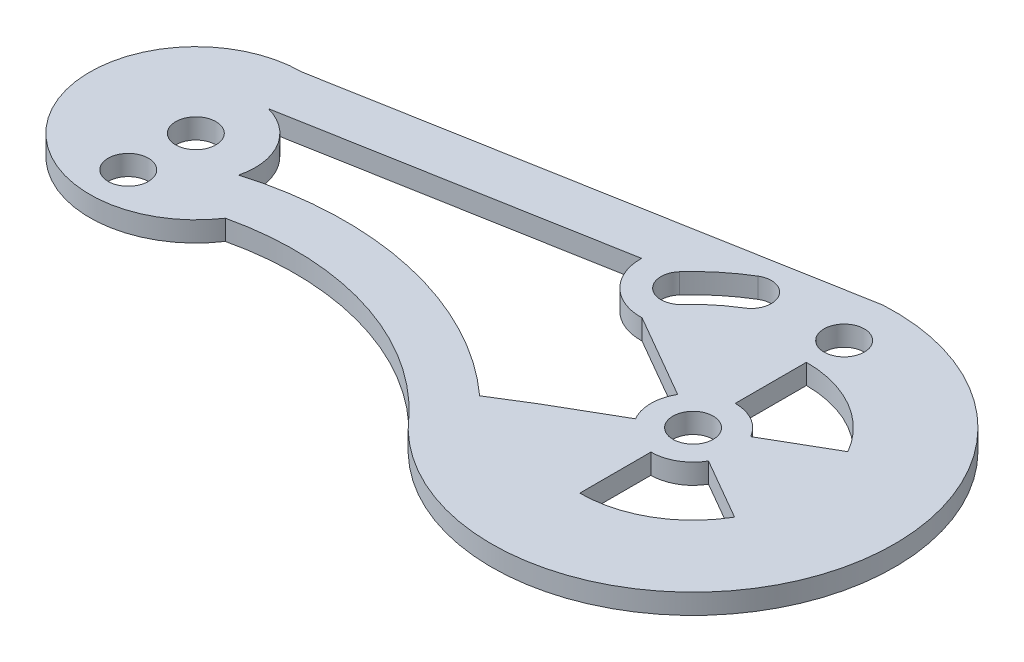
from build123d import *

# Parameters (mm, degrees)
SKETCH1_R           = 2
BOSS_EXTRUDE2_DEPTH = 2


with BuildPart() as part:
    # Sketch1 → Boss-Extrude2 (new body)
    with BuildSketch(Plane(origin=(0, 0, 0), x_dir=(1, 0, 0), z_dir=(0, 1, 0))):
        with BuildLine():
            Line((-33.676027055, 11.180582142), (15.211406628, 19.984204272))
            ThreePointArc((15.211406628, 19.984204272), (34.737966777, -7.78097648), (1.211790987, -13.090152535))
            ThreePointArc((1.211790987, -13.090152535), (-10.79582326, -5.653169844), (-24.912367612, -5.189826572))
            ThreePointArc((-24.912367612, -5.189826572), (-42.960314969, -4.320578887), (-33.676027055, 11.180582142))
        make_face()
        with Locations(Location((-33.676027055, 0.649629179, 0), (0, 0, 270))):
            Circle(SKETCH1_R, mode=Mode.SUBTRACT)
        with Locations(Location((-33.886225149, -5.846971221, 0), (0, 0, 270))):
            Circle(SKETCH1_R, mode=Mode.SUBTRACT)
        with Locations(Location((16.319944597, 0.014949315, 0), (0, 0, 270))):
            Circle(SKETCH1_R, mode=Mode.SUBTRACT)
        with Locations(Location((16.319944597, 15.014949315, 0), (0, 0, 270))):
            Circle(SKETCH1_R, mode=Mode.SUBTRACT)
        with BuildLine():
            Line((-32.205991929, 6.364880551), (-0.796707678, 12.021047159))
            ThreePointArc((-0.796707678, 12.021047159), (0.683130465, 8.373787285), (4.344424088, 6.929019304))
            Line((4.344424088, 6.929019304), (12.69431881, 2.108205339))
            ThreePointArc((12.69431881, 2.108205339), (12.133432549, 0.014949315), (12.69431881, -2.07830671))
            Line((12.69431881, -2.07830671), (6.575597959, -5.61095184))
            Line((6.575597959, -5.61095184), (2.986337283, -7.83499068))
            ThreePointArc((2.986337283, -7.83499068), (-11.570908116, -0.280369046), (-27.962567795, -0.827355859))
            ThreePointArc((-27.962567795, -0.827355859), (-28.59343775, 3.648360156), (-32.205991929, 6.364880551))
        make_face(mode=Mode.SUBTRACT)
        with BuildLine():
            Line((16.319944597, 4.201461363), (16.319944597, 11.266751624))
            ThreePointArc((16.319944597, 11.266751624), (21.945845752, 9.759295953), (26.064291236, 5.64085047))
            Line((26.064291236, 5.64085047), (19.945570385, 2.108205339))
            ThreePointArc((19.945570385, 2.108205339), (18.413200622, 3.640575102), (16.319944597, 4.201461363))
        make_face(mode=Mode.SUBTRACT)
        with BuildLine():
            Line((19.945570385, -2.07830671), (26.064291236, -5.61095184))
            ThreePointArc((26.064291236, -5.61095184), (21.945845752, -9.729397324), (16.319944597, -11.236852995))
            Line((16.319944597, -11.236852995), (16.319944597, -4.171562734))
            ThreePointArc((16.319944597, -4.171562734), (18.413200622, -3.610676472), (19.945570385, -2.07830671))
        make_face(mode=Mode.SUBTRACT)
        with BuildLine():
            ThreePointArc((2.244741471, 12.762469116), (2.384407332, 9.940848466), (5.206027982, 10.080514326))
            ThreePointArc((5.206027982, 10.080514326), (5.413174271, 10.304609299), (5.624838222, 10.524442221))
            ThreePointArc((5.624838222, 10.524442221), (6.978596806, 11.744142082), (8.470307193, 12.790626759))
            ThreePointArc((8.470307193, 12.790626759), (8.519771502, 12.820887047), (8.569352462, 12.850955823))
            ThreePointArc((8.569352462, 12.850955823), (9.246853, 15.59359008), (6.504218744, 16.271090618))
            ThreePointArc((6.504218744, 16.271090618), (6.441427011, 16.233010062), (6.378783011, 16.194686965))
            ThreePointArc((6.378783011, 16.194686965), (4.489608616, 14.869368007), (2.775143075, 13.324680936))
            ThreePointArc((2.775143075, 13.324680936), (2.50708158, 13.046273859), (2.244741471, 12.762469116))
        make_face(mode=Mode.SUBTRACT)
    extrude(amount=BOSS_EXTRUDE2_DEPTH)


solid = part.part
